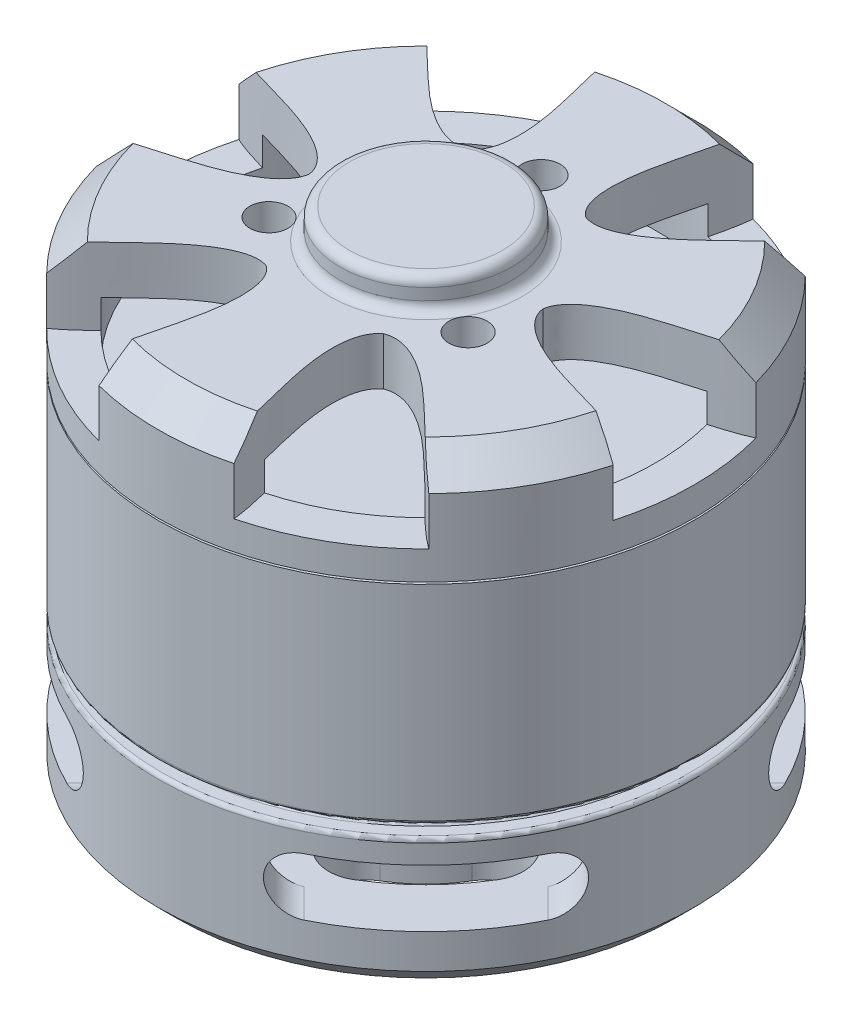
from build123d import *

# Parameters (mm, degrees)
SKETCH_1_R               = 14
SKETCH_1_R_2             = 1.25
EXTRUDE_1_DEPTH          = 7
CHAMFER_2_SIZE           = 1
SKETCH_2_R               = 13
EXTRUDE_2_DEPTH          = 0.6
SKETCH_3_R               = 14
EXTRUDE_3_DEPTH          = 10.9
SKETCH_5_R               = 13.5
EXTRUDE_4_DEPTH          = 0.1
SKETCH_6_R               = 14
SKETCH_6_R_2             = 12
EXTRUDE_5_DEPTH          = 3
SKETCH_8_R               = 14
EXTRUDE_6_DEPTH          = 2.5
CHAMFER_1_SIZE           = 1.5
CUT_EXTRUDE_2_DEPTH      = 4
SKETCH_11_R              = 4.5
EXTRUDE_7_DEPTH          = 1.6
FILLET_1_R               = 0.5
FILLET_2_R               = 0.2
SKETCH_12_R              = 3
EXTRUDE_8_DEPTH          = 1.6
FILLET_3_R               = 1
CUT_EXTRUDE_3_REACH      = 34.442
SKETCH_13_R              = 1
CUT_EXTRUDE_4_DEPTH      = 25
PATTERN_CIRCULAR_1_COUNT = 2
PATTERN_CIRCULAR_1_ANGLE = 90
SKETCH_15_R              = 12
CUT_EXTRUDE_5_DEPTH      = 4.2


with BuildPart() as part:
    # 草图1 → 凸台-拉伸1 (new body)
    with BuildSketch(Plane(origin=(0, 0, 0), x_dir=(1, 0, 0), z_dir=(0, 1, 0))):
        with Locations(Location((0, 0, 0), (0, 0, 270))):
            Circle(SKETCH_1_R)
        with Locations(Location((0, 8, 0), (0, 0, 270))):
            Circle(SKETCH_1_R_2, mode=Mode.SUBTRACT)
        with Locations(Location((9.5, 0, 0), (0, 0, 270))):
            Circle(SKETCH_1_R_2, mode=Mode.SUBTRACT)
        with Locations(Location((0, -8, 0), (0, 0, 90))):
            Circle(SKETCH_1_R_2, mode=Mode.SUBTRACT)
        with Locations(Location((-9.5, 0, 0), (0, 0, 90))):
            Circle(SKETCH_1_R_2, mode=Mode.SUBTRACT)
        with BuildLine():
            ThreePointArc((-5.665418824, 9.428840308), (-7.778174593, 7.778174593), (-9.428840308, 5.665418824))
            ThreePointArc((-9.428840308, 5.665418824), (-8.744581856, 2.921008073), (-6.000171105, 3.605266524))
            ThreePointArc((-6.000171105, 3.605266524), (-4.949747468, 4.949747468), (-3.605266524, 6.000171105))
            ThreePointArc((-3.605266524, 6.000171105), (-2.921008073, 8.744581856), (-5.665418824, 9.428840308))
        make_face(mode=Mode.SUBTRACT)
        with BuildLine():
            ThreePointArc((6.000171105, 3.605266524), (4.949747468, 4.949747468), (3.605266524, 6.000171105))
            ThreePointArc((3.605266524, 6.000171105), (2.921008073, 8.744581856), (5.665418824, 9.428840308))
            ThreePointArc((5.665418824, 9.428840308), (7.778174593, 7.778174593), (9.428840308, 5.665418824))
            ThreePointArc((9.428840308, 5.665418824), (8.744581856, 2.921008073), (6.000171105, 3.605266524))
        make_face(mode=Mode.SUBTRACT)
        with BuildLine():
            ThreePointArc((3.605266524, -6.000171105), (4.949747468, -4.949747468), (6.000171105, -3.605266524))
            ThreePointArc((6.000171105, -3.605266524), (8.744581856, -2.921008073), (9.428840308, -5.665418824))
            ThreePointArc((9.428840308, -5.665418824), (7.778174593, -7.778174593), (5.665418824, -9.428840308))
            ThreePointArc((5.665418824, -9.428840308), (2.921008073, -8.744581856), (3.605266524, -6.000171105))
        make_face(mode=Mode.SUBTRACT)
        with BuildLine():
            ThreePointArc((-6.000171105, -3.605266524), (-4.949747468, -4.949747468), (-3.605266524, -6.000171105))
            ThreePointArc((-3.605266524, -6.000171105), (-2.921008073, -8.744581856), (-5.665418824, -9.428840308))
            ThreePointArc((-5.665418824, -9.428840308), (-7.778174593, -7.778174593), (-9.428840308, -5.665418824))
            ThreePointArc((-9.428840308, -5.665418824), (-8.744581856, -2.921008073), (-6.000171105, -3.605266524))
        make_face(mode=Mode.SUBTRACT)
    extrude(amount=EXTRUDE_1_DEPTH)

    # 倒角2
    chamfer_2_edges = [part.edges().sort_by_distance(p)[0] for p in [
        (0, 0, -14),
    ]]
    chamfer(chamfer_2_edges, length=CHAMFER_2_SIZE)

    # 草图2 → 凸台-拉伸2 (add)
    with BuildSketch(Plane(origin=(0, 7, 0), x_dir=(1, 0, 0), z_dir=(0, 1, 0))):
        with Locations(Location((0, 0, 0), (0, 0, 270))):
            Circle(SKETCH_2_R)
    extrude(amount=EXTRUDE_2_DEPTH)

    # 草图3 → 凸台-拉伸3 (add)
    with BuildSketch(Plane(origin=(0, 7.6, 0), x_dir=(1, 0, 0), z_dir=(0, 1, 0))):
        with Locations(Location((0, 0, 0), (0, 0, 270))):
            Circle(SKETCH_3_R)
    extrude(amount=EXTRUDE_3_DEPTH)

    # 草图5 → 凸台-拉伸4 (add)
    with BuildSketch(Plane(origin=(0, 18.5, 0), x_dir=(1, 0, 0), z_dir=(0, 1, 0))):
        with Locations(Location((0, 0, 0), (0, 0, 270))):
            Circle(SKETCH_5_R)
    extrude(amount=EXTRUDE_4_DEPTH)

    # 草图6 → 凸台-拉伸5 (add)
    with BuildSketch(Plane(origin=(0, 18.6, 0), x_dir=(1, 0, 0), z_dir=(0, 1, 0))):
        with Locations(Location((0, 0, 0), (0, 0, 270))):
            Circle(SKETCH_6_R)
        with Locations(Location((0, 0, 0), (0, 0, 270))):
            Circle(SKETCH_6_R_2, mode=Mode.SUBTRACT)
    extrude(amount=EXTRUDE_5_DEPTH)

    # 草图8 → 凸台-拉伸6 (add)
    with BuildSketch(Plane(origin=(0, 21.6, 0), x_dir=(1, 0, 0), z_dir=(0, 1, 0))):
        with Locations(Location((0, 0, 0), (0, 0, 270))):
            Circle(SKETCH_8_R)
    extrude(amount=EXTRUDE_6_DEPTH)

    # 倒角1
    chamfer_1_edges = [part.edges().sort_by_distance(p)[0] for p in [
        (0, 24.1, -14),
    ]]
    chamfer(chamfer_1_edges, length=CHAMFER_1_SIZE)

    # 草图10 → 切除-拉伸2 (cut)
    with BuildSketch(Plane(origin=(0, 24.1, 0), x_dir=(1, 0, 0), z_dir=(0, 1, 0))):
        with BuildLine():
            Line((2.487272593, 16.094197048), (2.487272593, 18.774584575))
            Line((2.487272593, 18.774584575), (10.147359425, 18.007330684))
            Line((10.147359425, 18.007330684), (15.480360602, 10.834650807))
            Line((15.480360602, 10.834650807), (12.694347201, 10.201139776))
            add(Edge.make_bspline(
                [(12.694347201, 10.201139776), (10.725801083, 11.569624465), (7.531734695, 6.777071029), (3.873354196, 4.934297009), (3.048165968, 5.279578326)],
                knots=[0, 0, 0, 0, 0.56293624, 0.825224094, 0.825224094, 0.825224094, 0.825224094], degree=3))
            add(Edge.make_bspline(
                [(2.487272593, 16.094197048), (4.656688157, 15.073628446), (2.103248327, 9.911209095), (2.336549462, 5.821571636), (3.048165968, 5.279578326)],
                knots=[0, 0, 0, 0, 0.56293624, 0.825224094, 0.825224094, 0.825224094, 0.825224094], degree=3))
        make_face()
        with BuildLine():
            Line((15.181619794, 5.893057272), (17.502903484, 7.233251035))
            Line((17.502903484, 7.233251035), (20.668485539, 0.215794298))
            Line((20.668485539, 0.215794298), (17.123263141, -7.989060137))
            Line((17.123263141, -7.989060137), (15.181619794, -5.893057272))
            add(Edge.make_bspline(
                [(15.181619794, -5.893057272), (15.38248924, -3.504003982), (9.634983022, -3.134138065), (6.209903658, -0.887274627), (6.096331935, 0)],
                knots=[0, 0, 0, 0, 0.56293624, 0.825224094, 0.825224094, 0.825224094, 0.825224094], degree=3))
            add(Edge.make_bspline(
                [(15.181619794, 5.893057272), (15.38248924, 3.504003982), (9.634983022, 3.134138065), (6.209903658, 0.887274627), (6.096331935, 0)],
                knots=[0, 0, 0, 0, 0.56293624, 0.825224094, 0.825224094, 0.825224094, 0.825224094], degree=3))
        make_face()
        with BuildLine():
            Line((12.694347201, -10.201139776), (15.015630891, -11.541333539))
            Line((15.015630891, -11.541333539), (10.521126114, -17.791536385))
            Line((10.521126114, -17.791536385), (1.642902539, -18.823710944))
            Line((1.642902539, -18.823710944), (2.487272593, -16.094197048))
            add(Edge.make_bspline(
                [(2.487272593, -16.094197048), (4.656688157, -15.073628446), (2.103248327, -9.911209095), (2.336549462, -5.821571636), (3.048165968, -5.279578326)],
                knots=[0, 0, 0, 0, 0.56293624, 0.825224094, 0.825224094, 0.825224094, 0.825224094], degree=3))
            add(Edge.make_bspline(
                [(12.694347201, -10.201139776), (10.725801083, -11.569624465), (7.531734695, -6.777071029), (3.873354196, -4.934297009), (3.048165968, -5.279578326)],
                knots=[0, 0, 0, 0, 0.56293624, 0.825224094, 0.825224094, 0.825224094, 0.825224094], degree=3))
        make_face()
        with BuildLine():
            Line((-2.487272593, -16.094197048), (-2.487272593, -18.774584575))
            Line((-2.487272593, -18.774584575), (-10.147359425, -18.007330684))
            Line((-10.147359425, -18.007330684), (-15.480360602, -10.834650807))
            Line((-15.480360602, -10.834650807), (-12.694347201, -10.201139776))
            add(Edge.make_bspline(
                [(-12.694347201, -10.201139776), (-10.725801083, -11.569624465), (-7.531734695, -6.777071029), (-3.873354196, -4.934297009), (-3.048165968, -5.279578326)],
                knots=[0, 0, 0, 0, 0.56293624, 0.825224094, 0.825224094, 0.825224094, 0.825224094], degree=3))
            add(Edge.make_bspline(
                [(-2.487272593, -16.094197048), (-4.656688157, -15.073628446), (-2.103248327, -9.911209095), (-2.336549462, -5.821571636), (-3.048165968, -5.279578326)],
                knots=[0, 0, 0, 0, 0.56293624, 0.825224094, 0.825224094, 0.825224094, 0.825224094], degree=3))
        make_face()
        with BuildLine():
            Line((-15.181619794, -5.893057272), (-17.502903484, -7.233251035))
            Line((-17.502903484, -7.233251035), (-20.668485539, -0.215794298))
            Line((-20.668485539, -0.215794298), (-17.123263141, 7.989060137))
            Line((-17.123263141, 7.989060137), (-15.181619794, 5.893057272))
            add(Edge.make_bspline(
                [(-15.181619794, 5.893057272), (-15.38248924, 3.504003982), (-9.634983022, 3.134138065), (-6.209903658, 0.887274627), (-6.096331935, 0)],
                knots=[0, 0, 0, 0, 0.56293624, 0.825224094, 0.825224094, 0.825224094, 0.825224094], degree=3))
            add(Edge.make_bspline(
                [(-15.181619794, -5.893057272), (-15.38248924, -3.504003982), (-9.634983022, -3.134138065), (-6.209903658, -0.887274627), (-6.096331935, 0)],
                knots=[0, 0, 0, 0, 0.56293624, 0.825224094, 0.825224094, 0.825224094, 0.825224094], degree=3))
        make_face()
        with BuildLine():
            Line((-12.694347201, 10.201139776), (-15.015630891, 11.541333539))
            Line((-15.015630891, 11.541333539), (-10.521126114, 17.791536385))
            Line((-10.521126114, 17.791536385), (-1.642902539, 18.823710944))
            Line((-1.642902539, 18.823710944), (-2.487272593, 16.094197048))
            add(Edge.make_bspline(
                [(-2.487272593, 16.094197048), (-4.656688157, 15.073628446), (-2.103248327, 9.911209095), (-2.336549462, 5.821571636), (-3.048165968, 5.279578326)],
                knots=[0, 0, 0, 0, 0.56293624, 0.825224094, 0.825224094, 0.825224094, 0.825224094], degree=3))
            add(Edge.make_bspline(
                [(-12.694347201, 10.201139776), (-10.725801083, 11.569624465), (-7.531734695, 6.777071029), (-3.873354196, 4.934297009), (-3.048165968, 5.279578326)],
                knots=[0, 0, 0, 0, 0.56293624, 0.825224094, 0.825224094, 0.825224094, 0.825224094], degree=3))
        make_face()
    extrude(amount=-CUT_EXTRUDE_2_DEPTH, mode=Mode.SUBTRACT)

    # 草图11 → 凸台-拉伸7 (add)
    with BuildSketch(Plane(origin=(0, 24.1, 0), x_dir=(1, 0, 0), z_dir=(0, 1, 0))):
        with Locations(Location((0, 0, 0), (0, 0, 270))):
            Circle(SKETCH_11_R)
    extrude(amount=EXTRUDE_7_DEPTH)

    # 圆角1
    fillet_1_edges = [part.edges().sort_by_distance(p)[0] for p in [
        (0, 24.1, -4.5),
        (0, 25.7, -4.5),
    ]]
    fillet(fillet_1_edges, radius=FILLET_1_R)

    # 圆角2
    fillet_2_edges = [part.edges().sort_by_distance(p)[0] for p in [
        (0, 7.6, -14),
        (0, 7, -14),
        (0, 7, -13),
        (0, 7.6, -13),
    ]]
    fillet(fillet_2_edges, radius=FILLET_2_R)

    # 草图12 → 凸台-拉伸8 (add)
    with BuildSketch(Plane(origin=(0, 0, 0), x_dir=(-1, 0, 0), z_dir=(0, -1, 0))):
        with Locations(Location((0, 0, 0), (0, 0, 270))):
            Circle(SKETCH_12_R)
    extrude(amount=EXTRUDE_8_DEPTH)

    # 圆角3
    fillet_3_edges = [part.edges().sort_by_distance(p)[0] for p in [
        (0, -1.6, -3),
    ]]
    fillet(fillet_3_edges, radius=FILLET_3_R)

    # 草图13 → 切除-拉伸3 (cut, up to next)
    with BuildSketch(Plane(origin=(0, 24.1, 0), x_dir=(1, 0, 0), z_dir=(0, 1, 0)), mode=Mode.PRIVATE) as cut_extrude_3_sk1:
        with Locations(Location((0, 6, 0), (0, 0, 270))):
            Circle(SKETCH_13_R)
    cut_extrude_3_tool1 = extrude(cut_extrude_3_sk1.sketch, amount=-CUT_EXTRUDE_3_REACH, mode=Mode.PRIVATE) & part.part
    # 草图13 → 切除-拉伸3 (cut, up to next)
    with BuildSketch(Plane(origin=(0, 24.1, 0), x_dir=(1, 0, 0), z_dir=(0, 1, 0)), mode=Mode.PRIVATE) as cut_extrude_3_sk2:
        with Locations(Location((5.196152423, -3, 0), (0, 0, 270))):
            Circle(SKETCH_13_R)
    cut_extrude_3_tool2 = extrude(cut_extrude_3_sk2.sketch, amount=-CUT_EXTRUDE_3_REACH, mode=Mode.PRIVATE) & part.part
    # 草图13 → 切除-拉伸3 (cut, up to next)
    with BuildSketch(Plane(origin=(0, 24.1, 0), x_dir=(1, 0, 0), z_dir=(0, 1, 0)), mode=Mode.PRIVATE) as cut_extrude_3_sk3:
        with Locations(Location((-5.196152423, -3, 0), (0, 0, 270))):
            Circle(SKETCH_13_R)
    cut_extrude_3_tool3 = extrude(cut_extrude_3_sk3.sketch, amount=-CUT_EXTRUDE_3_REACH, mode=Mode.PRIVATE) & part.part
    add(cut_extrude_3_tool1.solids().sort_by_distance((0, 24.1, -6))[0], mode=Mode.SUBTRACT)
    add(cut_extrude_3_tool2.solids().sort_by_distance((5.196152, 24.1, 3))[0], mode=Mode.SUBTRACT)
    add(cut_extrude_3_tool3.solids().sort_by_distance((-5.196152, 24.1, 3))[0], mode=Mode.SUBTRACT)

    # 草图14 → 切除-拉伸4 (cut, symmetric)
    with BuildSketch(Plane(origin=(0, 0, 0), x_dir=(0.7071067811865477, 0, 0.7071067811865475), z_dir=(-0.7071067811865475, 0, 0.7071067811865477))):
        with BuildLine():
            Line((-4.5, 5.8), (4.5, 5.8))
            ThreePointArc((4.5, 5.8), (6, 4.3), (4.5, 2.8))
            Line((4.5, 2.8), (-4.5, 2.8))
            ThreePointArc((-4.5, 2.8), (-6, 4.3), (-4.5, 5.8))
        make_face()
    cut_extrude_4 = extrude(amount=CUT_EXTRUDE_4_DEPTH, both=True, mode=Mode.SUBTRACT)

    # 阵列(圆周)1: 切除-拉伸4 ×2 about axis
    pattern_circular_1_axis = Axis((0, 0, 0), (0, 1, 0))
    for i in range(1, PATTERN_CIRCULAR_1_COUNT):
        add(cut_extrude_4.rotate(pattern_circular_1_axis, i * PATTERN_CIRCULAR_1_ANGLE / (PATTERN_CIRCULAR_1_COUNT - 1)), mode=Mode.SUBTRACT)

    # 草图15 → 切除-拉伸5 (cut)
    with BuildSketch(Plane(origin=(0, 2.8, 0), x_dir=(1, 0, 0), z_dir=(0, 1, 0))):
        with Locations(Location((0, 0, 0), (0, 0, 105.206345281))):
            Circle(SKETCH_15_R)
    extrude(amount=CUT_EXTRUDE_5_DEPTH, mode=Mode.SUBTRACT)


solid = part.part
